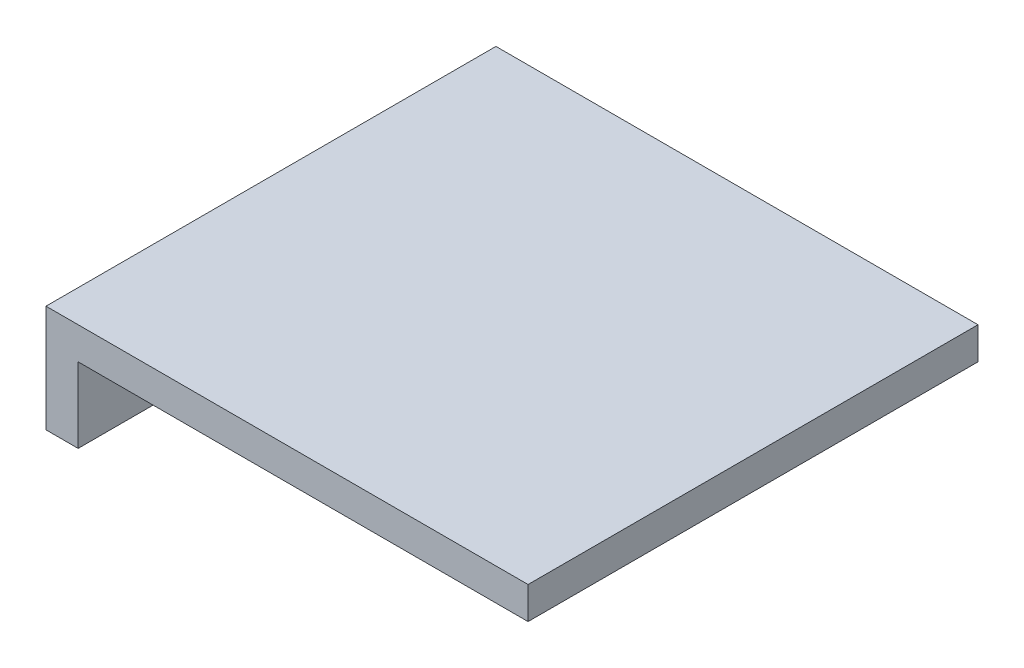
from build123d import *

# Parameters (mm, degrees)
BOSS_EXTRUDE1_DEPTH = 42


with BuildPart() as part:
    # Sketch1 → Boss-Extrude1 (new body)
    with BuildSketch(Plane.XY):
        Polygon((-3, 0), (-3, 10), (42, 10), (42, 7), (0, 7), (0, 0), align=None)
    extrude(amount=BOSS_EXTRUDE1_DEPTH)


solid = part.part
